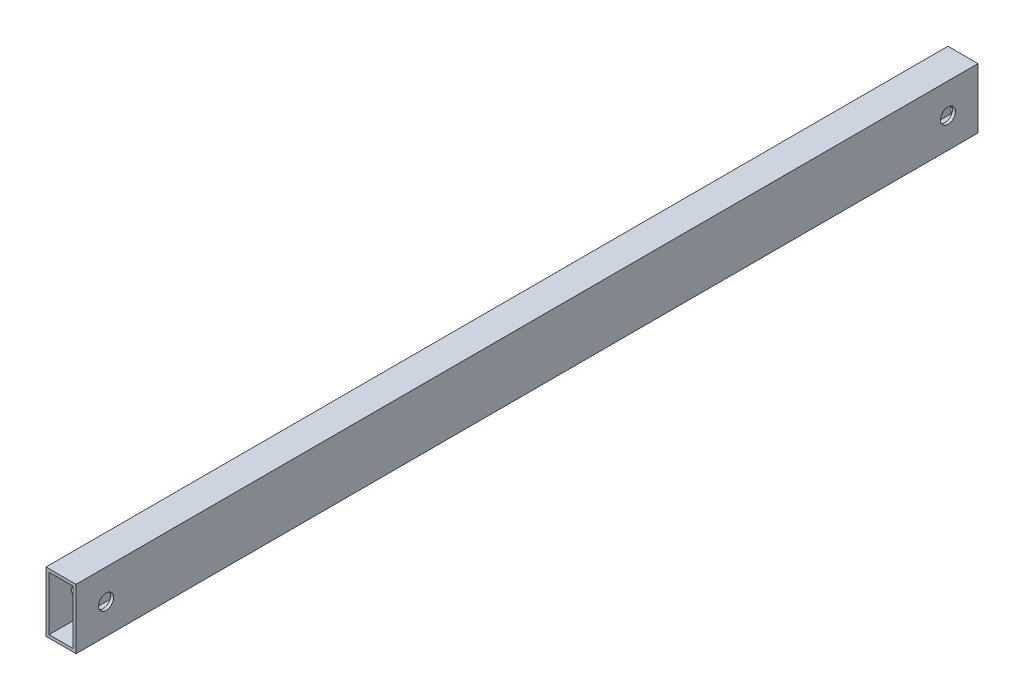
from build123d import *

# Parameters (mm, degrees)
SKETCH1_W           = 10
SKETCH1_H           = 20
SKETCH1_W_2         = 8
SKETCH1_H_2         = 18
BOSS_EXTRUDE1_DEPTH = 300
SKETCH2_R           = 2.5
CUT_EXTRUDE1_DEPTH  = 301.333148354


with BuildPart() as part:
    # Sketch1 → Boss-Extrude1 (new body)
    with BuildSketch(Plane.XY):
        Rectangle(SKETCH1_W, SKETCH1_H)
        Rectangle(SKETCH1_W_2, SKETCH1_H_2, mode=Mode.SUBTRACT)
    extrude(amount=BOSS_EXTRUDE1_DEPTH)

    # Sketch2 → Cut-Extrude1 (cut, through all)
    with BuildSketch(Plane(origin=(5, 0, 0), x_dir=(0, 0, -1), z_dir=(1, 0, 0))):
        with Locations((-10, 0)):
            Circle(SKETCH2_R)
        with Locations((-290, 0)):
            Circle(SKETCH2_R)
    extrude(amount=-CUT_EXTRUDE1_DEPTH, mode=Mode.SUBTRACT)


solid = part.part
